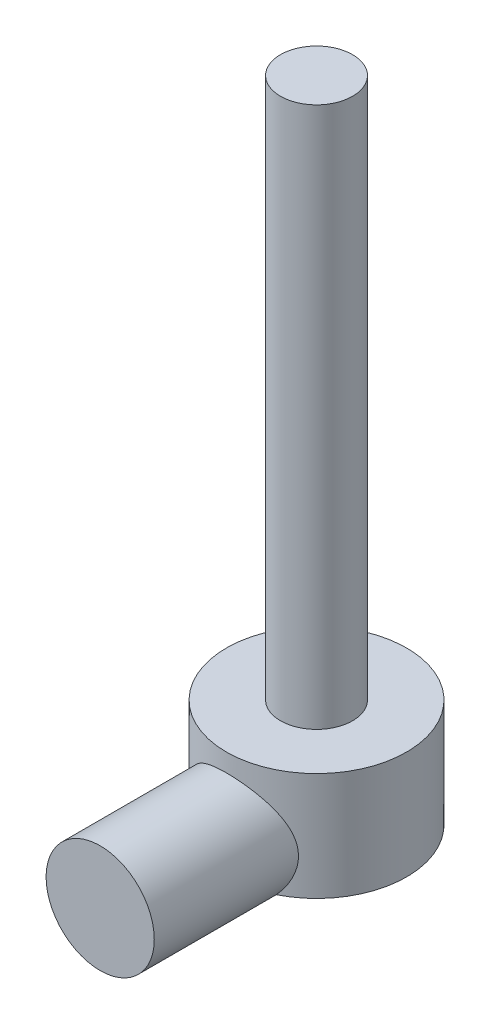
from build123d import *

# Parameters (mm, degrees)
SKETCH1_R                = 30
BOSS_EXTRUDE1_DEPTH      = 120
BOSS_EXTRUDE2_DEPTH      = 40
BOSS_EXTRUDE2_DEPTH_BACK = 20
SKETCH3_R                = 50
SKETCH4_R                = 20
BOSS_EXTRUDE3_DEPTH      = 300


with BuildPart() as part:
    # Sketch1 → Boss-Extrude1 (new body)
    with BuildSketch(Plane.XY):
        with Locations(Location((0, 0, 0), (0, 0, 180))):
            Circle(SKETCH1_R)
    extrude(amount=BOSS_EXTRUDE1_DEPTH)

    # Sketch3 → Boss-Extrude2 (add, two sides: drawn at the far end of the back side and taken through both)
    with BuildSketch(Plane(origin=(0, 0, 0), x_dir=(-1, 0, 0), z_dir=(0, 1, 0)).offset(-BOSS_EXTRUDE2_DEPTH_BACK)):
        with Locations(Location((0, 0, 0), (0, 0, 90))):
            Circle(SKETCH3_R)
    extrude(amount=BOSS_EXTRUDE2_DEPTH + BOSS_EXTRUDE2_DEPTH_BACK)

    # Sketch4 → Boss-Extrude3 (add)
    with BuildSketch(Plane(origin=(0, 40, 0), x_dir=(1, 0, 0), z_dir=(0, 1, 0))):
        with Locations(Location((0, 0, 0), (0, 0, 270))):
            Circle(SKETCH4_R)
    extrude(amount=BOSS_EXTRUDE3_DEPTH)


solid = part.part
